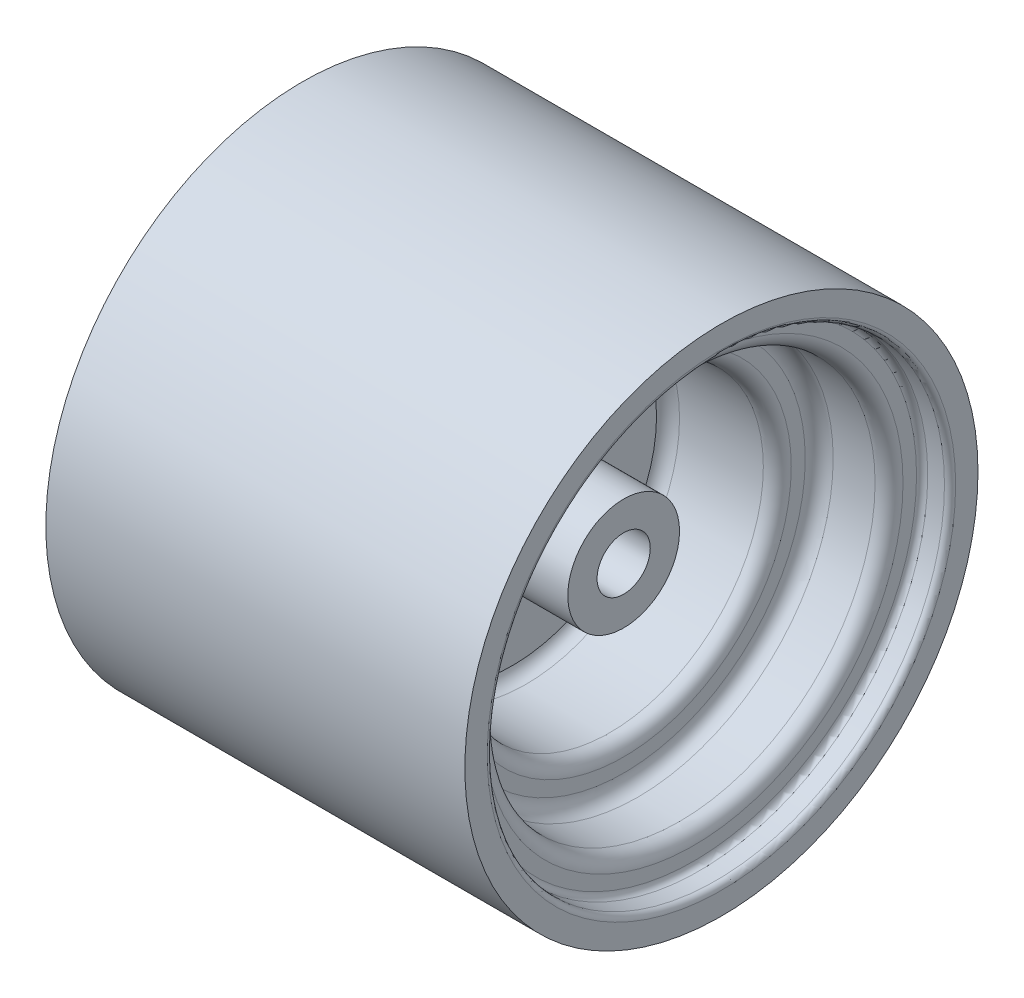
from build123d import *

# Parameters (mm, degrees)
SKETCH1_R           = 91.845
BOSS_EXTRUDE1_DEPTH = 150.24
SKETCH2_R           = 81.845
CUT_EXTRUDE1_DEPTH  = 10
SKETCH3_R           = 70
CUT_EXTRUDE2_DEPTH  = 25
SKETCH4_R           = 55
CUT_EXTRUDE3_DEPTH  = 40
SKETCH5_R           = 20
BOSS_EXTRUDE3_DEPTH = 40
SKETCH6_R           = 91.845
CUT_EXTRUDE4_DEPTH  = 75
FILLET1_R           = 2
FILLET2_R           = 5
FILLET3_R           = 5
FILLET4_R           = 2
FILLET5_R           = 5
FILLET6_R           = 5
FILLET7_R           = 2
SKETCH7_R           = 9.525
CUT_EXTRUDE5_DEPTH  = 75


with BuildPart() as part:
    # Sketch1 → Boss-Extrude1 (new body)
    with BuildSketch(Plane(origin=(0, 0, 0), x_dir=(0, 0, -1), z_dir=(1, 0, 0))):
        Circle(SKETCH1_R)
    extrude(amount=BOSS_EXTRUDE1_DEPTH)

    # Sketch2 → Cut-Extrude1 (cut)
    with BuildSketch(Plane(origin=(150.24, 0, 0), x_dir=(0, 0, -1), z_dir=(1, 0, 0))):
        Circle(SKETCH2_R)
    extrude(amount=-CUT_EXTRUDE1_DEPTH, mode=Mode.SUBTRACT)

    # Sketch3 → Cut-Extrude2 (cut)
    with BuildSketch(Plane(origin=(140.24, 0, 0), x_dir=(0, 0, -1), z_dir=(1, 0, 0))):
        Circle(SKETCH3_R)
    extrude(amount=-CUT_EXTRUDE2_DEPTH, mode=Mode.SUBTRACT)

    # Sketch4 → Cut-Extrude3 (cut)
    with BuildSketch(Plane(origin=(115.24, 0, 0), x_dir=(0, 0, -1), z_dir=(1, 0, 0))):
        Circle(SKETCH4_R)
    extrude(amount=-CUT_EXTRUDE3_DEPTH, mode=Mode.SUBTRACT)

    # Sketch5 → Boss-Extrude3 (add)
    with BuildSketch(Plane(origin=(75.24, 0, 0), x_dir=(0, 0, -1), z_dir=(1, 0, 0))):
        Circle(SKETCH5_R)
    extrude(amount=BOSS_EXTRUDE3_DEPTH)

    # Sketch6 → Cut-Extrude4 (cut)
    with BuildSketch(Plane.ZY):
        Circle(SKETCH6_R)
    extrude(amount=-CUT_EXTRUDE4_DEPTH, mode=Mode.SUBTRACT)

    # Fillet1
    fillet1_edges = [part.edges().sort_by_distance(p)[0] for p in [
        (150.24, 0, 81.845),
    ]]
    fillet(fillet1_edges, radius=FILLET1_R)

    # Fillet2
    fillet2_edges = [part.edges().sort_by_distance(p)[0] for p in [
        (140.24, 0, 70),
    ]]
    fillet(fillet2_edges, radius=FILLET2_R)

    # Fillet3
    fillet3_edges = [part.edges().sort_by_distance(p)[0] for p in [
        (115.24, 0, 70),
    ]]
    fillet(fillet3_edges, radius=FILLET3_R)

    # Fillet4
    fillet4_edges = [part.edges().sort_by_distance(p)[0] for p in [
        (140.24, 0, 81.845),
    ]]
    fillet(fillet4_edges, radius=FILLET4_R)

    # Fillet5
    fillet5_edges = [part.edges().sort_by_distance(p)[0] for p in [
        (115.24, 0, 55),
    ]]
    fillet(fillet5_edges, radius=FILLET5_R)

    # Fillet6
    fillet6_edges = [part.edges().sort_by_distance(p)[0] for p in [
        (75.24, 0, 55),
    ]]
    fillet(fillet6_edges, radius=FILLET6_R)

    # Fillet7
    fillet7_edges = [part.edges().sort_by_distance(p)[0] for p in [
        (75.24, 0, 20),
    ]]
    fillet(fillet7_edges, radius=FILLET7_R)

    # Sketch7 → Cut-Extrude5 (cut)
    with BuildSketch(Plane(origin=(115.24, 0, 0), x_dir=(0, 0, -1), z_dir=(1, 0, 0))):
        Circle(SKETCH7_R)
    extrude(amount=-CUT_EXTRUDE5_DEPTH, mode=Mode.SUBTRACT)

    # Mirror9: part across plane


with BuildPart() as part_1:
    add(part.part)
    add(part.part.mirror(Plane(origin=(75.24, 0, 0), x_dir=(0, 0, 1), z_dir=(1, 0, 0))))


solid = part_1.part
